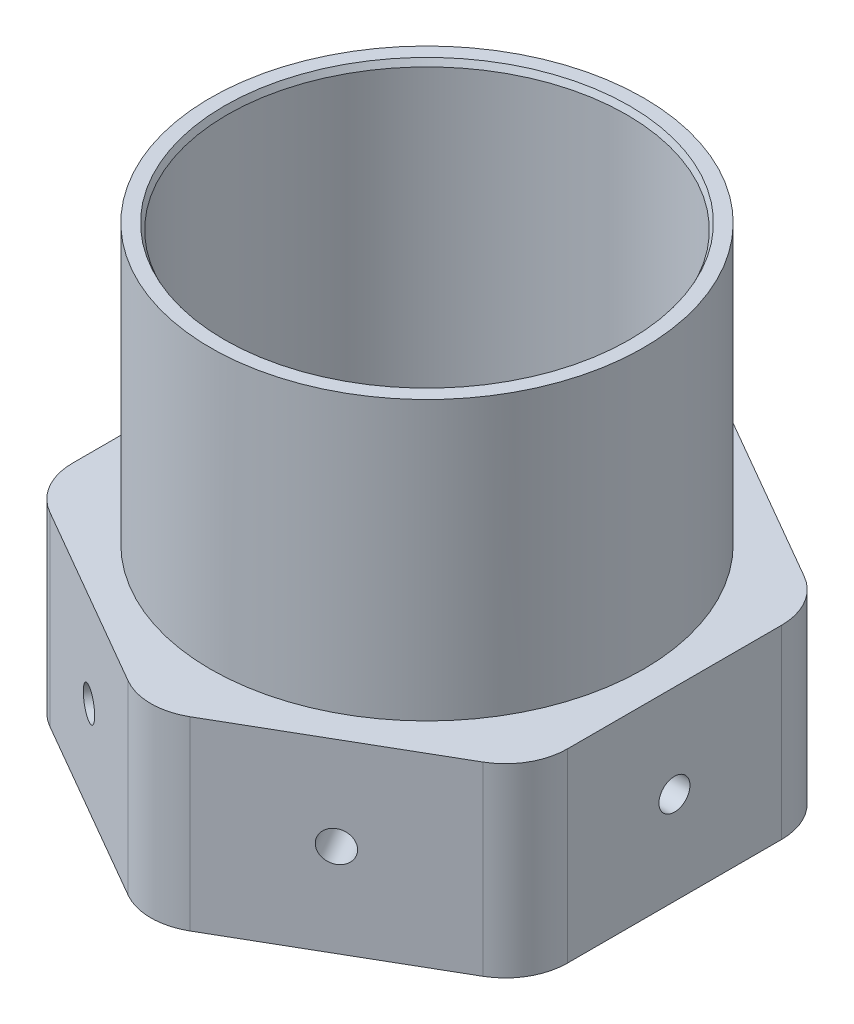
from build123d import *

# Parameters (mm, degrees)
SKETCH1_R           = 40.9956
BOSS_EXTRUDE1_DEPTH = 38.1
SKETCH2_R           = 3.18135
CUT_EXTRUDE1_DEPTH  = 29.464
CIRPATTERN1_COUNT   = 6
SKETCH3_R           = 44.45
SKETCH3_R_2         = 40.9956
BOSS_EXTRUDE2_DEPTH = 57.15
FILLET1_R           = 12.7
CHAMFER1_SIZE       = 1.27
CHAMFER1_SIZE2      = 0.592210726


with BuildPart() as part:
    # Sketch1 → Boss-Extrude1 (new body)
    with BuildSketch(Plane(origin=(0, 0, 0), x_dir=(1, 0, 0), z_dir=(0, 1, 0))):
        Polygon((0, -58.65878735), (50.8, -29.329393675), (50.8, 29.329393675), (0, 58.65878735), (-50.8, 29.329393675), (-50.8, -29.329393675), align=None)
        with Locations(Location((0, 0, 0), (0, 0, 90))):
            Circle(SKETCH1_R, mode=Mode.SUBTRACT)
    extrude(amount=BOSS_EXTRUDE1_DEPTH)

    # Sketch2 → Cut-Extrude1 (cut)
    with BuildSketch(Plane.ZY.offset(50.8)):
        with Locations((0, 19.05)):
            Circle(SKETCH2_R)
    cut_extrude1 = extrude(amount=-CUT_EXTRUDE1_DEPTH, mode=Mode.SUBTRACT)

    # CirPattern1: Cut-Extrude1 ×6 about axis
    cirpattern1_axis = Axis((0, 38.1, 0), (0, 1, 0))
    for i in range(1, CIRPATTERN1_COUNT):
        add(cut_extrude1.rotate(cirpattern1_axis, i * 360 / CIRPATTERN1_COUNT), mode=Mode.SUBTRACT)

    # Sketch3 → Boss-Extrude2 (add)
    with BuildSketch(Plane(origin=(-50.8, 38.1, -29.329393675), x_dir=(1, 0, 0), z_dir=(0, -1, 0))):
        with Locations(Location((50.8, 29.329393675, 0), (0, 0, 270))):
            Circle(SKETCH3_R)
        with Locations(Location((50.8, 29.329393675, 0), (0, 0, 270))):
            Circle(SKETCH3_R_2, mode=Mode.SUBTRACT)
    extrude(amount=-BOSS_EXTRUDE2_DEPTH)

    # Fillet1
    fillet1_edges = [part.edges().sort_by_distance(p)[0] for p in [
        (-50.8, 19.05, 29.329393675),
        (-50.8, 19.05, -29.329393675),
        (0, 19.05, -58.65878735),
        (50.8, 19.05, -29.329393675),
        (50.8, 19.05, 29.329393675),
        (0, 19.05, 58.65878735),
    ]]
    fillet(fillet1_edges, radius=FILLET1_R)

    # Chamfer1
    chamfer1_edges = [part.edges().sort_by_distance(p)[0] for p in [
        (0, 0, 40.9956),
        (0, 95.25, 40.9956),
    ]]
    chamfer1_side = [part.faces().sort_by_distance(p)[0] for p in [
        (0, 47.625, 40.9956),
    ]]
    chamfer(chamfer1_edges, length=CHAMFER1_SIZE, length2=CHAMFER1_SIZE2, reference=chamfer1_side[0])


solid = part.part
